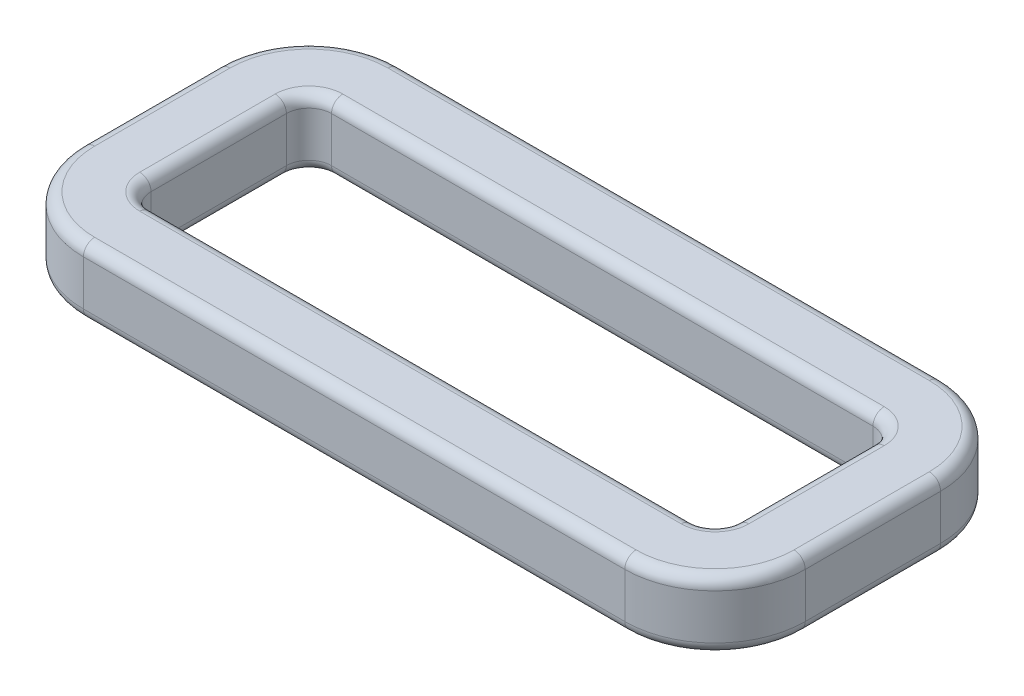
from build123d import *

# Parameters (mm, degrees)
BOSS_EXTRUDE1_DEPTH = 3
FILLET1_R           = 0.5


with BuildPart() as part:
    # Sketch1 → Boss-Extrude1 (new body)
    with BuildSketch(Plane(origin=(0, 0, 0), x_dir=(1, 0, 0), z_dir=(0, 1, 0))):
        with BuildLine():
            Line((-12, 7), (12, 7))
            ThreePointArc((12, 7), (14.828427125, 5.828427125), (16, 3))
            Line((16, 3), (16, -3))
            ThreePointArc((16, -3), (14.828427125, -5.828427125), (12, -7))
            Line((12, -7), (-12, -7))
            ThreePointArc((-12, -7), (-14.828427125, -5.828427125), (-16, -3))
            Line((-16, -3), (-16, 3))
            ThreePointArc((-16, 3), (-14.828427125, 5.828427125), (-12, 7))
        make_face()
        with BuildLine():
            Line((-12, 4), (12, 4))
            ThreePointArc((12, 4), (12.707106781, 3.707106781), (13, 3))
            Line((13, 3), (13, -3))
            ThreePointArc((13, -3), (12.707106781, -3.707106781), (12, -4))
            Line((12, -4), (-12, -4))
            ThreePointArc((-12, -4), (-12.707106781, -3.707106781), (-13, -3))
            Line((-13, -3), (-13, 3))
            ThreePointArc((-13, 3), (-12.707106781, 3.707106781), (-12, 4))
        make_face(mode=Mode.SUBTRACT)
    extrude(amount=BOSS_EXTRUDE1_DEPTH)

    # Fillet1
    fillet1_edges = [part.edges().sort_by_distance(p)[0] for p in [
        (-14.828427125, 3, 5.828427125),
        (-16, 0, 0),
        (-14.828427125, 0, -5.828427125),
        (0, 3, 7),
        (14.828427125, 3, 5.828427125),
        (16, 3, 0),
        (14.828427125, 3, -5.828427125),
        (0, 3, -7),
        (12.707106781, 0, -3.707106781),
        (0, 0, -4),
        (-12.707106781, 0, -3.707106781),
        (-13, 0, 0),
        (-12.707106781, 0, 3.707106781),
        (0, 0, 4),
        (12.707106781, 0, 3.707106781),
        (13, 0, 0),
        (12.707106781, 3, -3.707106781),
        (0, 3, -4),
        (-12.707106781, 3, -3.707106781),
        (-13, 3, 0),
        (-12.707106781, 3, 3.707106781),
        (0, 3, 4),
        (12.707106781, 3, 3.707106781),
        (13, 3, 0),
        (-14.828427125, 3, -5.828427125),
        (-16, 3, 0),
        (0, 0, -7),
        (14.828427125, 0, -5.828427125),
        (16, 0, 0),
        (14.828427125, 0, 5.828427125),
        (0, 0, 7),
        (-14.828427125, 0, 5.828427125),
    ]]
    fillet(fillet1_edges, radius=FILLET1_R)


solid = part.part
